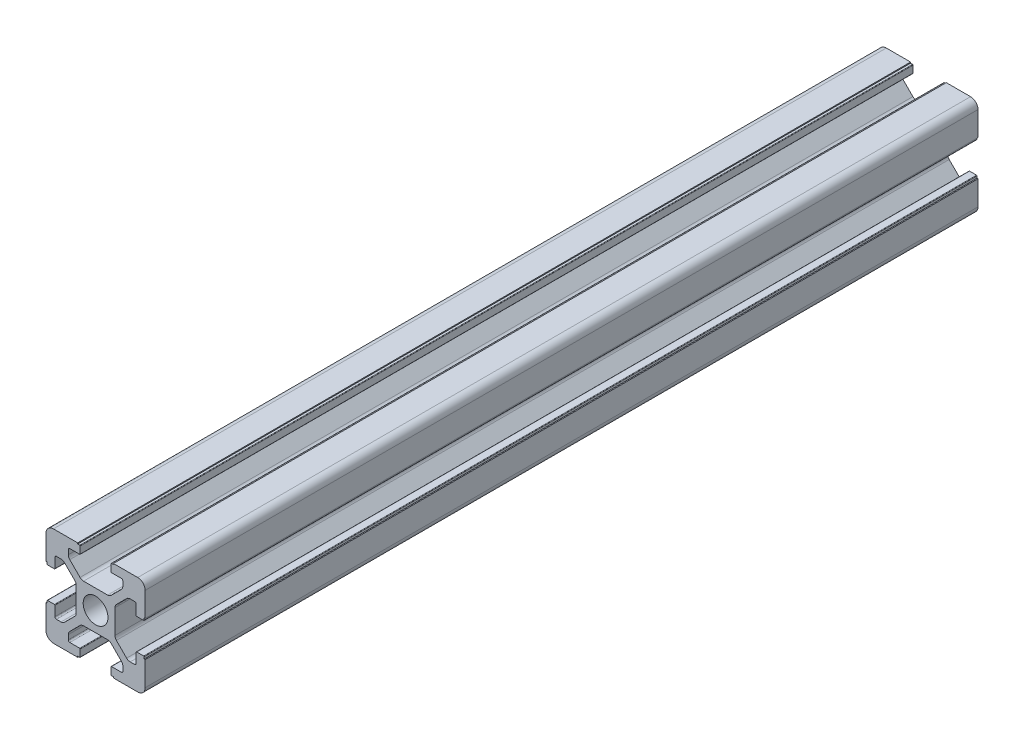
from build123d import *

# Parameters (mm, degrees)
SKETCH_1_R      = 2.5
EXTRUDE_1_DEPTH = 168
FILLET_1_R      = 1.5


with BuildPart() as part:
    # 草图1 → 凸台-拉伸1 (new body)
    with BuildSketch(Plane.XY):
        with BuildLine():
            Line((20, 13.6), (20, 20))
            Line((20, 20), (13.6, 20))
            Line((13.6, 20), (13.6, 19.8))
            Line((13.6, 19.8), (13.2, 19.8))
            ThreePointArc((13.2, 19.8), (13.129289322, 19.770710678), (13.1, 19.7))
            Line((13.1, 19.7), (13.1, 18.3))
            ThreePointArc((13.1, 18.3), (13.129289322, 18.229289322), (13.2, 18.2))
            Line((13.2, 18.2), (15.2, 18.2))
            ThreePointArc((15.2, 18.2), (15.412132034, 18.112132034), (15.5, 17.9))
            Line((15.5, 17.9), (15.5, 16.974873734))
            ThreePointArc((15.5, 16.974873734), (15.423879533, 16.592190302), (15.207106781, 16.267766953))
            Line((15.207106781, 16.267766953), (13.132233047, 14.192893219))
            ThreePointArc((13.132233047, 14.192893219), (12.807809698, 13.976120467), (12.425126266, 13.9))
            Line((12.425126266, 13.9), (7.574873734, 13.9))
            ThreePointArc((7.574873734, 13.9), (7.192190302, 13.976120467), (6.867766953, 14.192893219))
            Line((6.867766953, 14.192893219), (4.792893219, 16.267766953))
            ThreePointArc((4.792893219, 16.267766953), (4.576120467, 16.592190302), (4.5, 16.974873734))
            Line((4.5, 16.974873734), (4.5, 17.9))
            ThreePointArc((4.5, 17.9), (4.587867966, 18.112132034), (4.8, 18.2))
            Line((4.8, 18.2), (6.8, 18.2))
            ThreePointArc((6.8, 18.2), (6.870710678, 18.229289322), (6.9, 18.3))
            Line((6.9, 18.3), (6.9, 19.7))
            ThreePointArc((6.9, 19.7), (6.870710678, 19.770710678), (6.8, 19.8))
            Line((6.8, 19.8), (6.4, 19.8))
            Line((6.4, 19.8), (6.4, 20))
            Line((6.4, 20), (0, 20))
            Line((0, 20), (0, 13.6))
            Line((0, 13.6), (0.2, 13.6))
            Line((0.2, 13.6), (0.2, 13.2))
            ThreePointArc((0.2, 13.2), (0.229289322, 13.129289322), (0.3, 13.1))
            Line((0.3, 13.1), (1.7, 13.1))
            ThreePointArc((1.7, 13.1), (1.770710678, 13.129289322), (1.8, 13.2))
            Line((1.8, 13.2), (1.8, 15.2))
            ThreePointArc((1.8, 15.2), (1.887867966, 15.412132034), (2.1, 15.5))
            Line((2.1, 15.5), (3.025126266, 15.5))
            ThreePointArc((3.025126266, 15.5), (3.407809698, 15.423879533), (3.732233047, 15.207106781))
            Line((3.732233047, 15.207106781), (5.807106781, 13.132233047))
            ThreePointArc((5.807106781, 13.132233047), (6.023879533, 12.807809698), (6.1, 12.425126266))
            Line((6.1, 12.425126266), (6.1, 7.574873734))
            ThreePointArc((6.1, 7.574873734), (6.023879533, 7.192190302), (5.807106781, 6.867766953))
            Line((5.807106781, 6.867766953), (3.732233047, 4.792893219))
            ThreePointArc((3.732233047, 4.792893219), (3.407809698, 4.576120467), (3.025126266, 4.5))
            Line((3.025126266, 4.5), (2.1, 4.5))
            ThreePointArc((2.1, 4.5), (1.887867966, 4.587867966), (1.8, 4.8))
            Line((1.8, 4.8), (1.8, 6.8))
            ThreePointArc((1.8, 6.8), (1.770710678, 6.870710678), (1.7, 6.9))
            Line((1.7, 6.9), (0.3, 6.9))
            ThreePointArc((0.3, 6.9), (0.229289322, 6.870710678), (0.2, 6.8))
            Line((0.2, 6.8), (0.2, 6.4))
            Line((0.2, 6.4), (0, 6.4))
            Line((0, 6.4), (0, 0))
            Line((0, 0), (6.4, 0))
            Line((6.4, 0), (6.4, 0.2))
            Line((6.4, 0.2), (6.8, 0.2))
            ThreePointArc((6.8, 0.2), (6.870710678, 0.229289322), (6.9, 0.3))
            Line((6.9, 0.3), (6.9, 1.7))
            ThreePointArc((6.9, 1.7), (6.870710678, 1.770710678), (6.8, 1.8))
            Line((6.8, 1.8), (4.8, 1.8))
            ThreePointArc((4.8, 1.8), (4.587867966, 1.887867966), (4.5, 2.1))
            Line((4.5, 2.1), (4.5, 3.025126266))
            ThreePointArc((4.5, 3.025126266), (4.576120467, 3.407809698), (4.792893219, 3.732233047))
            Line((4.792893219, 3.732233047), (6.867766953, 5.807106781))
            ThreePointArc((6.867766953, 5.807106781), (7.192190302, 6.023879533), (7.574873734, 6.1))
            Line((7.574873734, 6.1), (12.425126266, 6.1))
            ThreePointArc((12.425126266, 6.1), (12.807809698, 6.023879533), (13.132233047, 5.807106781))
            Line((13.132233047, 5.807106781), (15.207106781, 3.732233047))
            ThreePointArc((15.207106781, 3.732233047), (15.423879533, 3.407809698), (15.5, 3.025126266))
            Line((15.5, 3.025126266), (15.5, 2.1))
            ThreePointArc((15.5, 2.1), (15.412132034, 1.887867966), (15.2, 1.8))
            Line((15.2, 1.8), (13.2, 1.8))
            ThreePointArc((13.2, 1.8), (13.129289322, 1.770710678), (13.1, 1.7))
            Line((13.1, 1.7), (13.1, 0.3))
            ThreePointArc((13.1, 0.3), (13.129289322, 0.229289322), (13.2, 0.2))
            Line((13.2, 0.2), (13.6, 0.2))
            Line((13.6, 0.2), (13.6, 0))
            Line((13.6, 0), (20, 0))
            Line((20, 0), (20, 6.4))
            Line((20, 6.4), (19.8, 6.4))
            Line((19.8, 6.4), (19.8, 6.8))
            ThreePointArc((19.8, 6.8), (19.770710678, 6.870710678), (19.7, 6.9))
            Line((19.7, 6.9), (18.3, 6.9))
            ThreePointArc((18.3, 6.9), (18.229289322, 6.870710678), (18.2, 6.8))
            Line((18.2, 6.8), (18.2, 4.8))
            ThreePointArc((18.2, 4.8), (18.112132034, 4.587867966), (17.9, 4.5))
            Line((17.9, 4.5), (16.974873734, 4.5))
            ThreePointArc((16.974873734, 4.5), (16.592190302, 4.576120467), (16.267766953, 4.792893219))
            Line((16.267766953, 4.792893219), (14.192893219, 6.867766953))
            ThreePointArc((14.192893219, 6.867766953), (13.976120467, 7.192190302), (13.9, 7.574873734))
            Line((13.9, 7.574873734), (13.9, 12.425126266))
            ThreePointArc((13.9, 12.425126266), (13.976120467, 12.807809698), (14.192893219, 13.132233047))
            Line((14.192893219, 13.132233047), (16.267766953, 15.207106781))
            ThreePointArc((16.267766953, 15.207106781), (16.592190302, 15.423879533), (16.974873734, 15.5))
            Line((16.974873734, 15.5), (17.9, 15.5))
            ThreePointArc((17.9, 15.5), (18.112132034, 15.412132034), (18.2, 15.2))
            Line((18.2, 15.2), (18.2, 13.2))
            ThreePointArc((18.2, 13.2), (18.229289322, 13.129289322), (18.3, 13.1))
            Line((18.3, 13.1), (19.7, 13.1))
            ThreePointArc((19.7, 13.1), (19.770710678, 13.129289322), (19.8, 13.2))
            Line((19.8, 13.2), (19.8, 13.6))
            Line((19.8, 13.6), (20, 13.6))
        make_face()
        with Locations(Location((10, 10, 0), (0, 0, 180))):
            Circle(SKETCH_1_R, mode=Mode.SUBTRACT)
    extrude(amount=EXTRUDE_1_DEPTH)

    # 圆角1
    fillet_1_edges = [part.edges().sort_by_distance(p)[0] for p in [
        (0, 0, 84),
        (0, 20, 84),
        (20, 20, 84),
        (20, 0, 84),
    ]]
    fillet(fillet_1_edges, radius=FILLET_1_R)


solid = part.part
